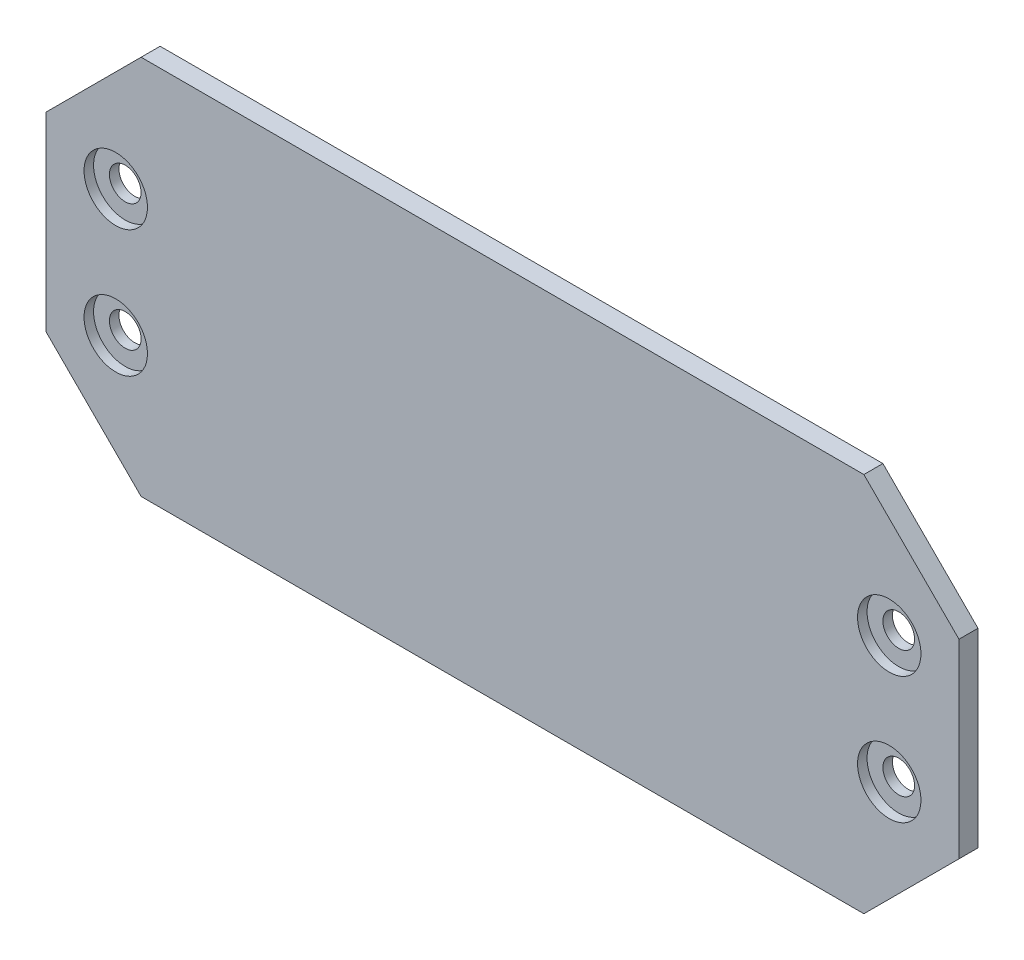
from build123d import *

# Parameters (mm, degrees)
SKETCH1_R           = 2.5
BOSS_EXTRUDE1_DEPTH = 3
SKETCH2_R           = 5
CUT_EXTRUDE1_DEPTH  = 1.5


with BuildPart() as part:
    # Sketch1 → Boss-Extrude1 (new body)
    with BuildSketch(Plane.XY):
        Polygon((-57, 30), (57, 30), (72, 15), (72, -15), (57, -30), (-57, -30), (-72, -15), (-72, 15), align=None)
        with Locations((-61, 10)):
            Circle(SKETCH1_R, mode=Mode.SUBTRACT)
        with Locations(Location((61, 10, 0), (0, 0, 180))):
            Circle(SKETCH1_R, mode=Mode.SUBTRACT)
        with Locations((61, -10)):
            Circle(SKETCH1_R, mode=Mode.SUBTRACT)
        with Locations(Location((-61, -10, 0), (0, 0, 180))):
            Circle(SKETCH1_R, mode=Mode.SUBTRACT)
    extrude(amount=BOSS_EXTRUDE1_DEPTH)

    # Sketch2 → Cut-Extrude1 (cut)
    with BuildSketch(Plane.XY.offset(3)):
        with Locations((-61, -10)):
            Circle(SKETCH2_R)
        with Locations((-61, 10)):
            Circle(SKETCH2_R)
        with Locations((61, 10)):
            Circle(SKETCH2_R)
        with Locations((61, -10)):
            Circle(SKETCH2_R)
    extrude(amount=-CUT_EXTRUDE1_DEPTH, mode=Mode.SUBTRACT)


solid = part.part
